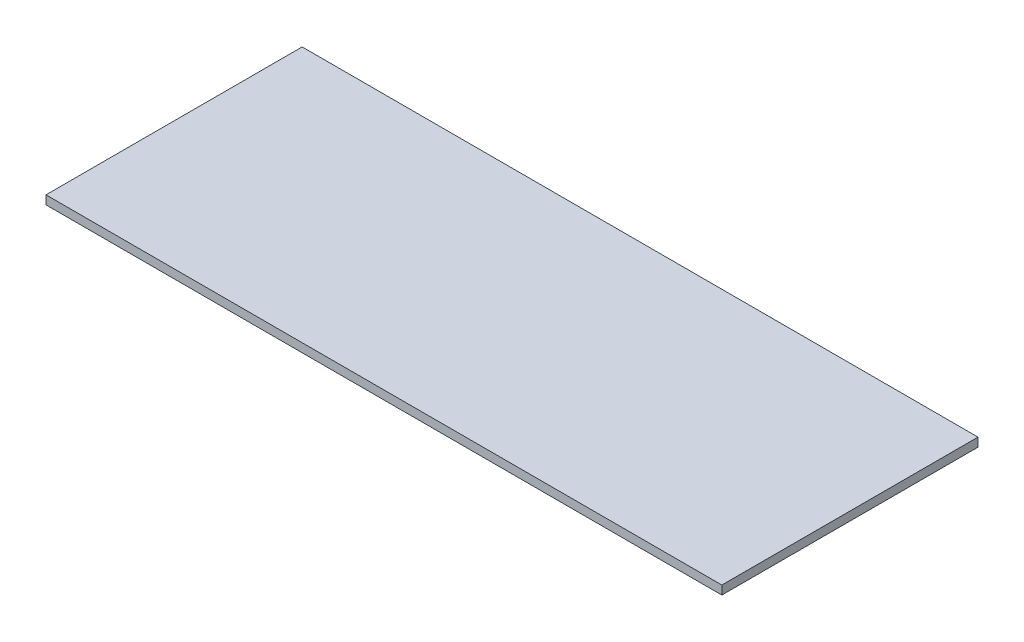
from build123d import *

# Parameters (mm, degrees)
SK_PCB_W                   = 124
SK_PCB_H                   = 47
PERFBOARD_124X47X1_6_DEPTH = 1.6


with BuildPart() as part:
    # Sk_PCB → Perfboard 124x47x1.6 (new body)
    with BuildSketch(Plane(origin=(0, 5.6, 0), x_dir=(1, 0, 0), z_dir=(0, 1, 0))):
        with Locations((66.4, 27.9)):
            Rectangle(SK_PCB_W, SK_PCB_H)
    extrude(amount=PERFBOARD_124X47X1_6_DEPTH)


solid = part.part
